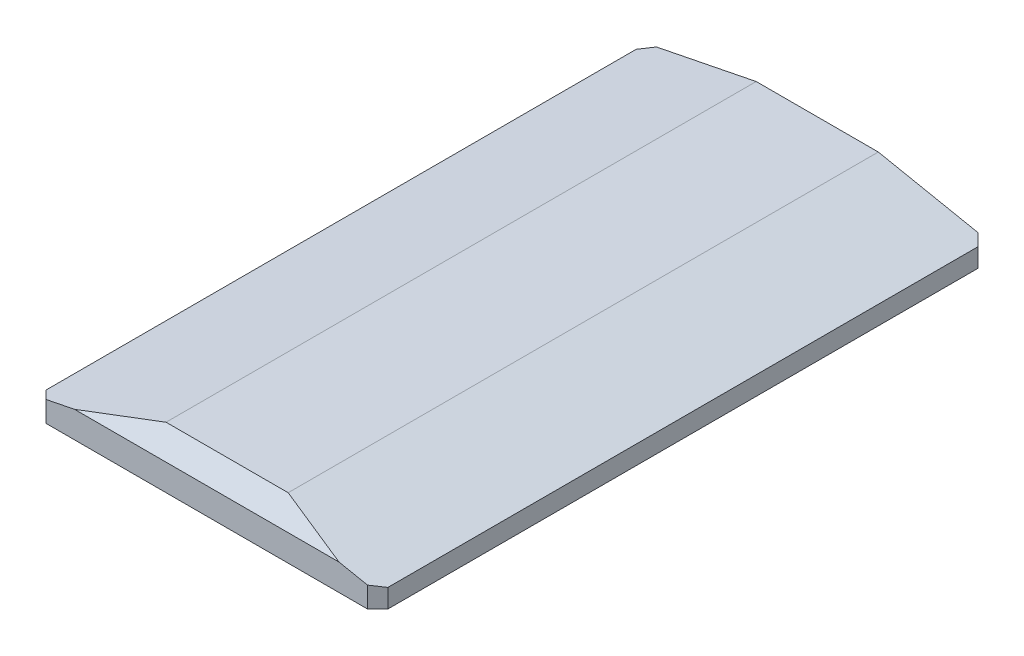
from build123d import *

# Parameters (mm, degrees)
EXTRUDE_1_DEPTH          = 26.5
EXTRUDE_1_DEPTH_BACK     = 3.5
CUT_EXTRUDE_1_DEPTH      = 28.950313057
CUT_EXTRUDE_1_DEPTH_BACK = 28.950313057
SKETCH_3_W               = 14.8
SKETCH_3_H               = 28
CUT_EXTRUDE_2_DEPTH      = 1
CHAMFER_1_SIZE           = 0.5
CHAMFER_2_SIZE           = 0.5


with BuildPart() as part:
    # Эскиз1 → Бобышка-Вытянуть1 (new, two sides: drawn at the far end of the back side and taken through both)
    with BuildSketch(Plane.XY.offset(-EXTRUDE_1_DEPTH_BACK)):
        Polygon((-2.439262184, 0.9), (2.439262184, 0.9), (8.4, 0.9), (8.4, 1.8), (8.4, 1.82), (3, 2.9), (-3, 2.9), (-8.4, 1.82), (-8.4, 1.8), (-8.4, 0.9), align=None)
    extrude(amount=EXTRUDE_1_DEPTH + EXTRUDE_1_DEPTH_BACK)

    # Эскиз2 → Вырез-Вытянуть1 (cut, two sides: drawn at the far end of the back side and taken through both)
    with BuildSketch(Plane(origin=(0, 0, 0), x_dir=(0, 0, -1), z_dir=(1, 0, 0)).offset(-CUT_EXTRUDE_1_DEPTH_BACK)):
        Polygon((-25.5, 2.9), (-26.5, 2.9), (-26.5, 2.2), align=None)
    extrude(amount=CUT_EXTRUDE_1_DEPTH + CUT_EXTRUDE_1_DEPTH_BACK, mode=Mode.SUBTRACT)

    # Эскиз3 → Вырез-Вытянуть2 (cut)
    with BuildSketch(Plane.XZ.offset(-0.9)):
        with Locations((0, 11.5)):
            Rectangle(SKETCH_3_W, SKETCH_3_H)
    extrude(amount=-CUT_EXTRUDE_2_DEPTH, mode=Mode.SUBTRACT)

    # Фаска1
    chamfer_1_edges = [part.edges().sort_by_distance(p)[0] for p in [
        (-7.4, 1.9, 11.5),
        (0, 1.9, 25.5),
        (7.4, 1.9, 11.5),
        (0, 1.9, -2.5),
    ]]
    chamfer(chamfer_1_edges, length=CHAMFER_1_SIZE)

    # Фаска2
    chamfer_2_edges = [part.edges().sort_by_distance(p)[0] for p in [
        (8.4, 1.36, 26.5),
        (-8.4, 1.36, 26.5),
        (-8.4, 1.36, -3.5),
        (8.4, 1.36, -3.5),
    ]]
    chamfer(chamfer_2_edges, length=CHAMFER_2_SIZE)


solid = part.part
